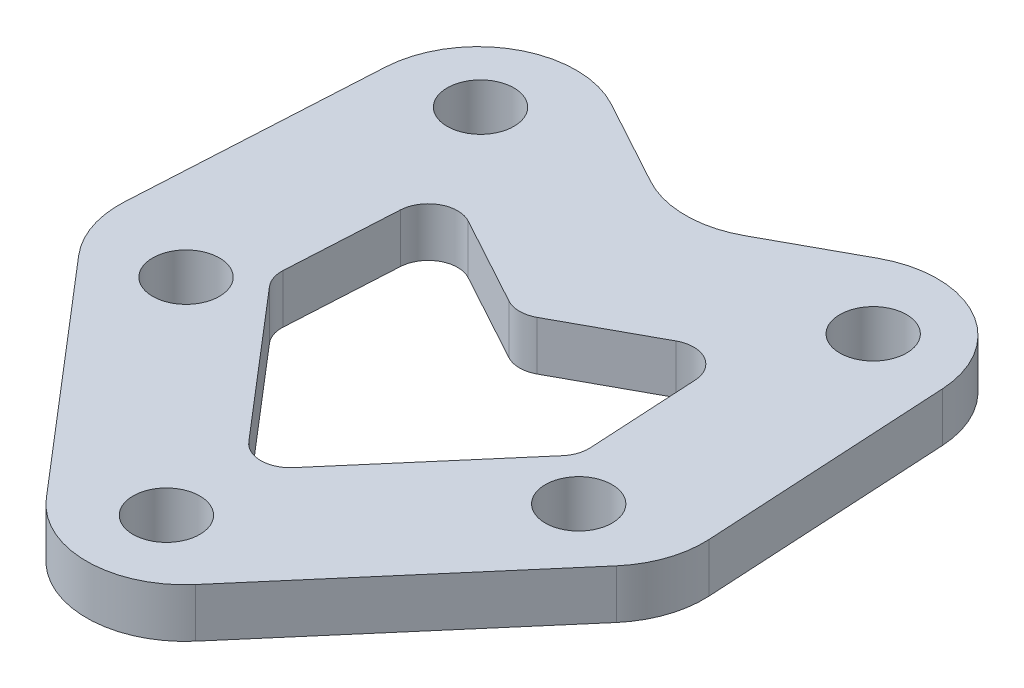
from build123d import *

# Parameters (mm, degrees)
BOSS_EXTRUDE1_DEPTH = 3.175
SKETCH2_R           = 2.159
CUT_EXTRUDE1_DEPTH  = 38.162422217
CUT_EXTRUDE2_DEPTH  = 38.162422217
FILLET1_R           = 6.35
FILLET2_R           = 1.905


with BuildPart() as part:
    # Sketch1 → Boss-Extrude1 (new body)
    with BuildSketch(Plane(origin=(0, 0, 0), x_dir=(1, 0, 0), z_dir=(0, 1, 0))):
        Polygon((-17.4625, 31.75), (0, 22.225), (17.4625, 31.75), (19.05, 3.175), (0, -19.05), (-19.05, 3.175), align=None)
    extrude(amount=BOSS_EXTRUDE1_DEPTH)

    # Sketch2 → Cut-Extrude1 (cut, through all)
    with BuildSketch(Plane(origin=(0, 3.175, 0), x_dir=(1, 0, 0), z_dir=(0, 1, 0))):
        with Locations(Location((0, -10.4775, 0), (0, 0, 270))):
            Circle(SKETCH2_R)
        with Locations(Location((-12.7, 3.4925, 0), (0, 0, 270))):
            Circle(SKETCH2_R)
        with Locations(Location((12.7, 3.4925, 0), (0, 0, 270))):
            Circle(SKETCH2_R)
        with Locations(Location((-12.7, 22.5425, 0), (0, 0, 270))):
            Circle(SKETCH2_R)
        with Locations(Location((12.7, 22.5425, 0), (0, 0, 270))):
            Circle(SKETCH2_R)
    extrude(amount=-CUT_EXTRUDE1_DEPTH, mode=Mode.SUBTRACT)

    # Sketch3 → Cut-Extrude2 (cut, through all)
    with BuildSketch(Plane(origin=(0, 3.175, 0), x_dir=(1, 0, 0), z_dir=(0, 1, 0))):
        Polygon((-9.366701395, 17.207620695), (-9.975545431, 6.248428041), (0, -5.389708296), (9.975545431, 6.248428041), (9.366701395, 17.207620695), (0, 12.098510843), align=None)
    extrude(amount=-CUT_EXTRUDE2_DEPTH, mode=Mode.SUBTRACT)

    # Fillet1
    fillet1_edges = [part.edges().sort_by_distance(p)[0] for p in [
        (-17.4625, 1.5875, -31.75),
        (0, 1.5875, -22.225),
        (17.4625, 1.5875, -31.75),
        (19.05, 1.5875, -3.175),
        (0, 1.5875, 19.05),
        (-19.05, 1.5875, -3.175),
    ]]
    fillet(fillet1_edges, radius=FILLET1_R)

    # Fillet2
    fillet2_edges = [part.edges().sort_by_distance(p)[0] for p in [
        (-9.366701395, 1.5875, -17.207620695),
        (0, 1.5875, -12.098510843),
        (9.366701395, 1.5875, -17.207620695),
        (9.975545431, 1.5875, -6.248428041),
        (0, 1.5875, 5.389708296),
        (-9.975545431, 1.5875, -6.248428041),
    ]]
    fillet(fillet2_edges, radius=FILLET2_R)


solid = part.part
